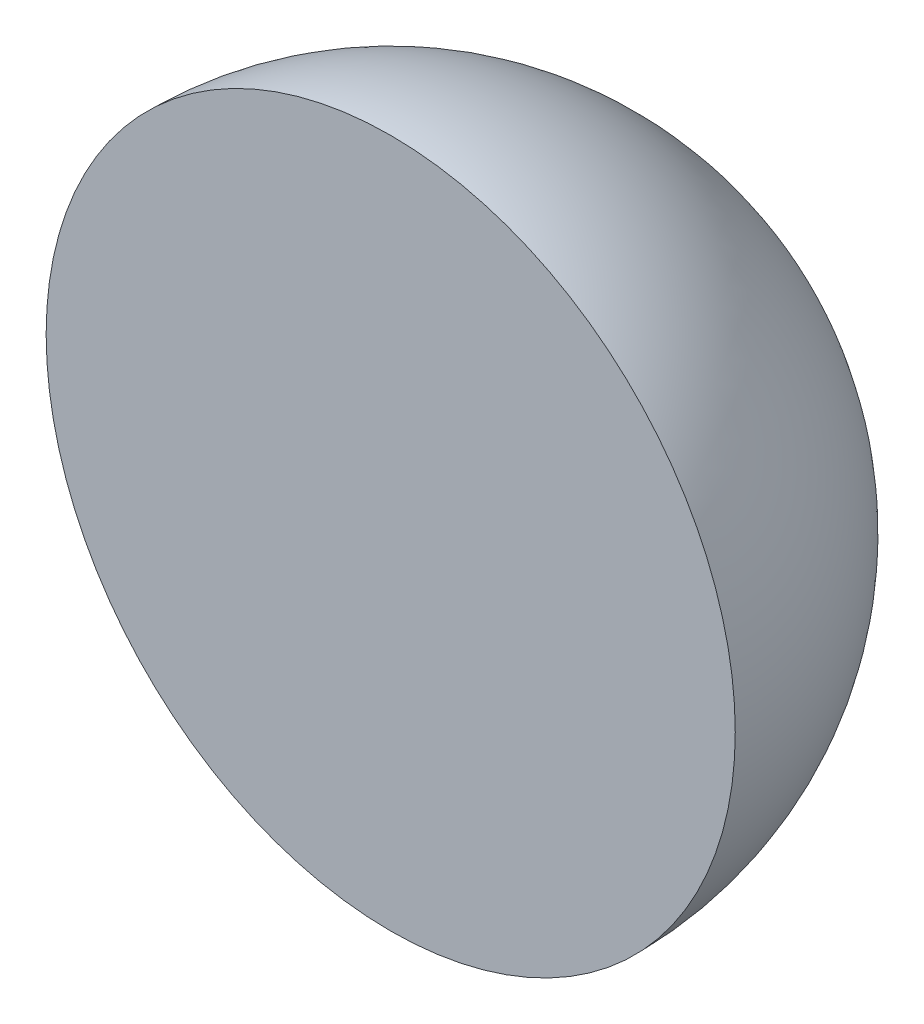
from build123d import *


with BuildPart() as part:
    # Sketch1 → Revolve2 (revolve)
    with BuildSketch(Plane(origin=(0, 0, 0), x_dir=(1, 0, 0), z_dir=(0, 1, 0))):
        with BuildLine():
            Line((0, 197.887626784), (0, 0))
            Line((0, 0), (197.887626784, 0))
            ThreePointArc((197.887626784, 0), (139.927682812, 139.927682812), (0, 197.887626784))
        make_face()
    revolve(axis=Axis((0, 0, -197.887626784), (0, 0, 1)))


solid = part.part
